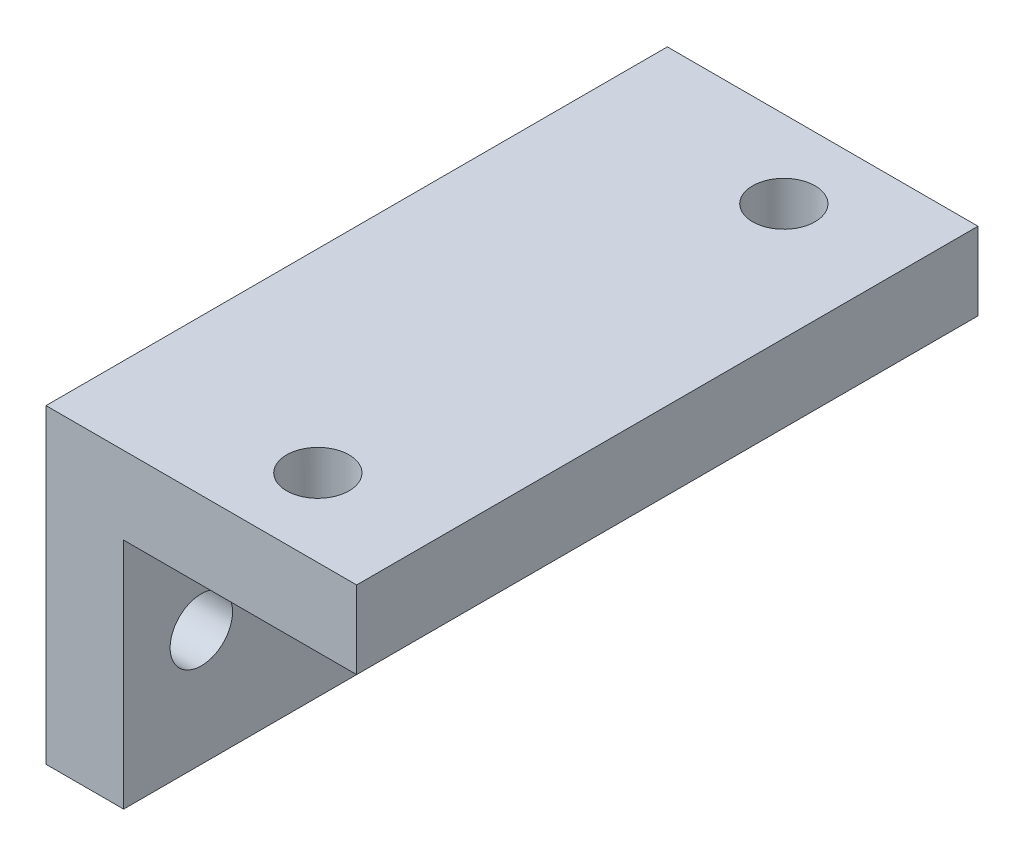
from build123d import *

# Parameters (mm, degrees)
BOSS_EXTRUDE1_DEPTH        = 25.4
F_10_CLEARANCE_HOLE1_D     = 5.1054
F_10_CLEARANCE_HOLE2_D     = 5.1054
F_10_CLEARANCE_HOLE2_DEPTH = 6.35
F_10_CLEARANCE_HOLE2_TIP   = 1.533816902


with BuildPart() as part:
    # Sketch1 → Boss-Extrude1 (new, symmetric)
    with BuildSketch(Plane.XY):
        Polygon((0, 0), (19.05, 0), (19.05, 6.35), (-6.35, 6.35), (-6.35, -19.05), (0, -19.05), align=None)
    extrude(amount=BOSS_EXTRUDE1_DEPTH, both=True)

    # #10 Clearance Hole1 (through all)
    with Locations(Plane(origin=(0, 0, 0), x_dir=(-1, 0, 0), z_dir=(0, -1, 0))):
        with Locations((-9.525, -19.05), (-9.525, 19.05)):
            Hole(F_10_CLEARANCE_HOLE1_D / 2)

    # #10 Clearance Hole2
    with Locations(Plane(origin=(0, 0, 0), x_dir=(0, 0, -1), z_dir=(1, 0, 0))):
        with Locations((19.05, -9.525), (-19.05, -9.525)):
            Hole(F_10_CLEARANCE_HOLE2_D / 2, depth=F_10_CLEARANCE_HOLE2_DEPTH)
            with Locations((0, 0, -(F_10_CLEARANCE_HOLE2_DEPTH + F_10_CLEARANCE_HOLE2_TIP / 2))):  # 118° drill point
                Cone(0, F_10_CLEARANCE_HOLE2_D / 2, F_10_CLEARANCE_HOLE2_TIP, mode=Mode.SUBTRACT)


solid = part.part
